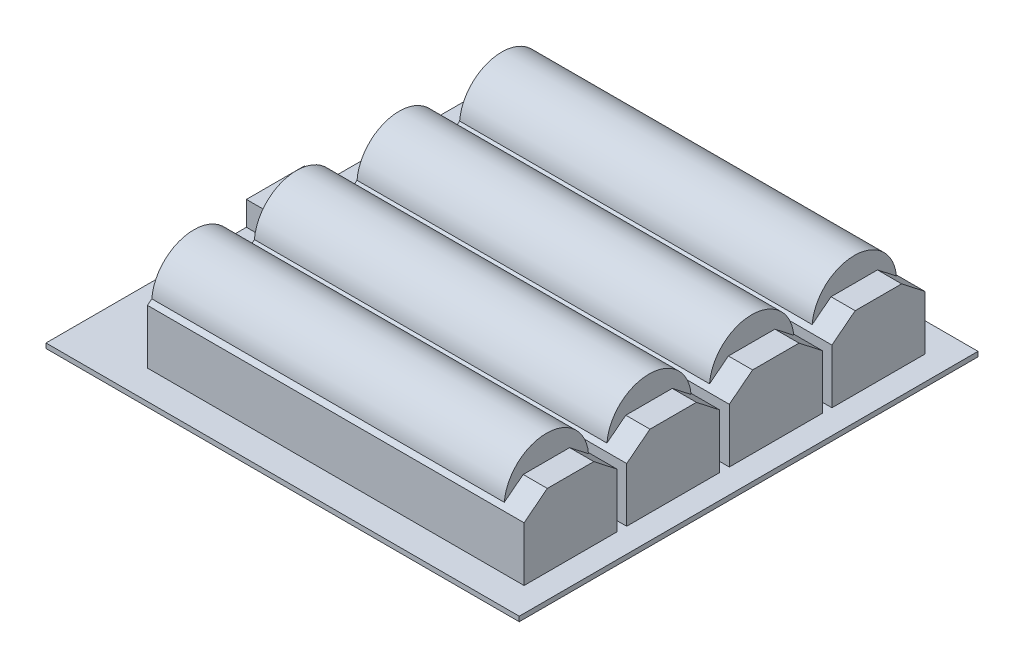
from build123d import *

# Parameters (mm, degrees)
SKETCH_1_W          = 98
SKETCH_1_H          = 95
EXTRUDE_1_DEPTH     = 1
SKETCH_2_W          = 78
SKETCH_2_H          = 85
EXTRUDE_2_DEPTH     = 20
CUT_EXTRUDE_1_DEPTH = 100
CUT_EXTRUDE_2_DEPTH = 5
SKETCH_5_W          = 9
SKETCH_5_H          = 12
EXTRUDE_3_DEPTH     = 5
SKETCH_6_W          = 11.2
SKETCH_6_H          = 4.6
SKETCH_6_W_2        = 10.2
SKETCH_6_H_2        = 1.749108458
CUT_EXTRUDE_4_DEPTH = 8
CUT_EXTRUDE_5_DEPTH = 0.5


with BuildPart() as part:
    # 스케치1 → 보스-돌출1 (new body)
    with BuildSketch(Plane(origin=(0, 0, 0), x_dir=(1, 0, 0), z_dir=(0, 1, 0))):
        Rectangle(SKETCH_1_W, SKETCH_1_H)
    extrude(amount=EXTRUDE_1_DEPTH)

    # 스케치2 → 보스-돌출2 (add)
    with BuildSketch(Plane(origin=(0, 1, 0), x_dir=(1, 0, 0), z_dir=(0, 1, 0))):
        with Locations((5, 0)):
            Rectangle(SKETCH_2_W, SKETCH_2_H)
    extrude(amount=EXTRUDE_2_DEPTH)

    # 스케치4 → 컷-돌출1 (cut)
    with BuildSketch(Plane(origin=(44, 0, 0), x_dir=(0, 0, -1), z_dir=(1, 0, 0))):
        with BuildLine():
            Line((-42.5, 1), (-41.5, 1))
            Line((-41.5, 1), (-41.5, 12.254740451))
            Line((-41.5, 12.254740451), (-40.591554577, 12.962724137))
            ThreePointArc((-40.591554577, 12.962724137), (-37.80324019, 18.684012014), (-31.875, 21))
            Line((-31.875, 21), (-42.5, 21))
            Line((-42.5, 21), (-42.5, 1))
        make_face()
        with BuildLine():
            Line((-22.25, 12.254740451), (-22.25, 1))
            Line((-22.25, 1), (-20.25, 1))
            Line((-20.25, 1), (-20.25, 12.254740451))
            Line((-20.25, 12.254740451), (-19.341554577, 12.962724137))
            ThreePointArc((-19.341554577, 12.962724137), (-16.553240185, 18.684012019), (-10.624999986, 21))
            Line((-10.624999986, 21), (-31.875, 21))
            ThreePointArc((-31.875, 21), (-25.94675981, 18.684012014), (-23.158445423, 12.962724137))
            Line((-23.158445423, 12.962724137), (-22.25, 12.254740451))
        make_face()
        with BuildLine():
            Line((-1, 12.254740451), (-1, 1))
            Line((-1, 1), (1, 1))
            Line((1, 1), (1, 12.254740451))
            Line((1, 12.254740451), (1.908445423, 12.962724137))
            ThreePointArc((1.908445423, 12.962724137), (4.696759796, 18.684012001), (10.62499996, 21))
            Line((10.62499996, 21), (-10.624999986, 21))
            ThreePointArc((-10.624999986, 21), (-4.696759805, 18.68401201), (-1.908445423, 12.962724137))
            Line((-1.908445423, 12.962724137), (-1, 12.254740451))
        make_face()
        with BuildLine():
            Line((20.25, 12.254740451), (20.25, 1))
            Line((20.25, 1), (22.25, 1))
            Line((22.25, 1), (22.25, 12.254740451))
            Line((22.25, 12.254740451), (23.158445423, 12.962724137))
            ThreePointArc((23.158445423, 12.962724137), (25.94675981, 18.684012014), (31.875, 21))
            Line((31.875, 21), (10.62499996, 21))
            ThreePointArc((10.62499996, 21), (16.553240175, 18.684012028), (19.341554577, 12.962724137))
            Line((19.341554577, 12.962724137), (20.25, 12.254740451))
        make_face()
        with BuildLine():
            Line((42.5, 21), (31.875, 21))
            ThreePointArc((31.875, 21), (37.80324019, 18.684012014), (40.591554577, 12.962724137))
            Line((40.591554577, 12.962724137), (41.5, 12.254740451))
            Line((41.5, 12.254740451), (41.5, 1))
            Line((41.5, 1), (42.5, 1))
            Line((42.5, 1), (42.5, 21))
        make_face()
    extrude(amount=-CUT_EXTRUDE_1_DEPTH, mode=Mode.SUBTRACT)

    # 스케치4<3> → 컷-돌출2 (cut)
    with BuildSketch(Plane(origin=(44, 0, 0), x_dir=(0, 0, -1), z_dir=(1, 0, 0))):
        with BuildLine():
            ThreePointArc((-23.158445423, 12.962724137), (-31.875, 21), (-40.591554577, 12.962724137))
            Line((-40.591554577, 12.962724137), (-36.685, 16.007240451))
            Line((-36.685, 16.007240451), (-27.065, 16.007240451))
            Line((-27.065, 16.007240451), (-23.158445423, 12.962724137))
        make_face()
        with BuildLine():
            Line((-5.815, 16.007240451), (-1.908445423, 12.962724137))
            ThreePointArc((-1.908445423, 12.962724137), (-10.625, 21), (-19.341554577, 12.962724137))
            Line((-19.341554577, 12.962724137), (-15.435, 16.007240451))
            Line((-15.435, 16.007240451), (-5.815, 16.007240451))
        make_face()
        with BuildLine():
            Line((36.685, 16.007240451), (40.591554577, 12.962724137))
            ThreePointArc((40.591554577, 12.962724137), (31.875, 21), (23.158445423, 12.962724137))
            Line((23.158445423, 12.962724137), (27.065, 16.007240451))
            Line((27.065, 16.007240451), (36.685, 16.007240451))
        make_face()
        with BuildLine():
            Line((15.435, 16.007240451), (19.341554577, 12.962724137))
            ThreePointArc((19.341554577, 12.962724137), (10.625, 21), (1.908445423, 12.962724137))
            Line((1.908445423, 12.962724137), (5.815, 16.007240451))
            Line((5.815, 16.007240451), (15.435, 16.007240451))
        make_face()
    extrude(amount=-CUT_EXTRUDE_2_DEPTH, mode=Mode.SUBTRACT)

    # 스케치5 → 보스-돌출3 (add)
    with BuildSketch(Plane(origin=(0, 1, 0), x_dir=(1, 0, 0), z_dir=(0, 1, 0))):
        with Locations((-44.5, 0)):
            Rectangle(SKETCH_5_W, SKETCH_5_H)
    extrude(amount=EXTRUDE_3_DEPTH)

    # 스케치6 → 컷-돌출4 (cut)
    with BuildSketch(Plane.ZY.offset(49)):
        with Locations((0, 3.3)):
            Rectangle(SKETCH_6_W, SKETCH_6_H)
        with Locations((0, 4.300145796)):
            Rectangle(SKETCH_6_W_2, SKETCH_6_H_2, mode=Mode.SUBTRACT)
    extrude(amount=-CUT_EXTRUDE_4_DEPTH, mode=Mode.SUBTRACT)

    # 스케치7 → 컷-돌출5 (cut)
    with BuildSketch(Plane(origin=(0, 6, 0), x_dir=(1, 0, 0), z_dir=(0, 1, 0))):
        Polygon((-42.731367286, 2.836850655), (-46.283445156, 2.836850655), (-47.255371975, 2.487236692), (-47.255371975, 1.305541495), (-46.33938339, 0.68322864), (-42.731367286, 0.68322864), (-42.731367286, 0.994385067), (-46.33938339, 0.994385067), (-46.960091467, 1.416087501), (-46.960091467, 2.396337061), (-46.33938339, 2.619613348), (-42.731367286, 2.619613348), align=None)
        Polygon((-42.731367286, -2.836850655), (-46.283445156, -2.836850655), (-47.255371975, -2.487236692), (-47.255371975, -1.305541495), (-46.33938339, -0.68322864), (-42.731367286, -0.68322864), (-42.731367286, -0.994385067), (-46.33938339, -0.994385067), (-46.960091467, -1.416087501), (-46.960091467, -2.396337061), (-46.33938339, -2.619613348), (-42.731367286, -2.619613348), align=None)
    extrude(amount=-CUT_EXTRUDE_5_DEPTH, mode=Mode.SUBTRACT)


solid = part.part
